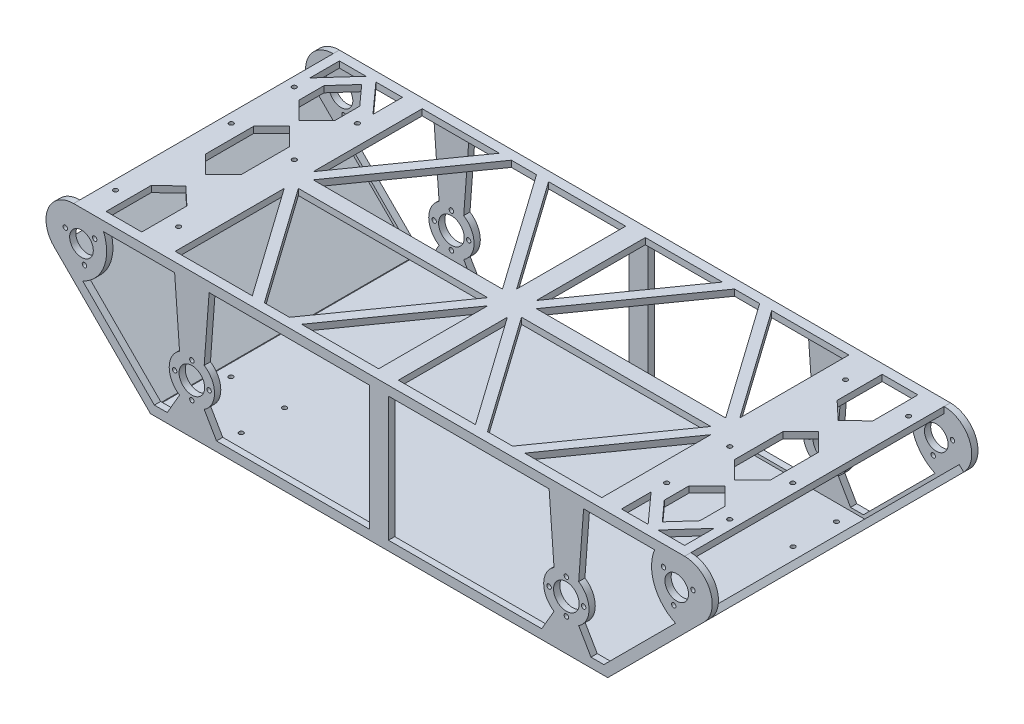
from build123d import *

# Parameters (mm, degrees)
SKETCH1_W               = 458.7573
SKETCH1_H               = 257
BOSS_EXTRUDE1_DEPTH     = 6.35
BOSS_EXTRUDE2_DEPTH     = 6.35
SKETCH3_W               = 619.980431394
SKETCH3_H               = 257
BOSS_EXTRUDE3_DEPTH     = 6.35
SKETCH5_W               = 269.7
SKETCH5_H               = 135.201969493
BOSS_EXTRUDE4_DEPTH     = 6.35
CUT_EXTRUDE1_DEPTH      = 455.343152175
CUT_EXTRUDE1_DEPTH_BACK = 455.343152175
SKETCH6_R               = 12
SKETCH6_R_2             = 13
SKETCH6_R_3             = 2.25
SKETCH7_R               = 2.25
CUT_EXTRUDE2_DEPTH      = 10
SKETCH8_R               = 2.25
CUT_EXTRUDE3_DEPTH      = 10
CUT_EXTRUDE4_DEPTH      = 455.343152175
CUT_EXTRUDE5_DEPTH      = 6.35


with BuildPart() as part:
    # Sketch1 → Boss-Extrude1 (new body)
    with BuildSketch(Plane(origin=(0, 0, 0), x_dir=(1, 0, 0), z_dir=(0, 1, 0))):
        Rectangle(SKETCH1_W, SKETCH1_H)
    extrude(amount=-BOSS_EXTRUDE1_DEPTH)

    # Sketch2 → Boss-Extrude2 (add)
    with BuildSketch(Plane.XY.offset(128.5)):
        with BuildLine():
            Line((329.824560909, 91.465654788), (232.008906121, -6.35))
            Line((232.008906121, -6.35), (-232.008906121, -6.35))
            Line((-232.008906121, -6.35), (-329.824560909, 91.465654788))
            ThreePointArc((-329.824560909, 91.465654788), (-335.905036583, 122.034270278), (-309.990215697, 139.35))
            Line((-309.990215697, 139.35), (309.990215697, 139.35))
            ThreePointArc((309.990215697, 139.35), (335.905036583, 122.034270278), (329.824560909, 91.465654788))
        make_face()
    boss_extrude2 = extrude(amount=BOSS_EXTRUDE2_DEPTH)

    # Mirror1: Boss-Extrude2 across plane
    add(boss_extrude2.mirror(Plane.XY))

    # Sketch3 → Boss-Extrude3 (add)
    with BuildSketch(Plane(origin=(0, 139.35, 0), x_dir=(1, 0, 0), z_dir=(0, 1, 0))):
        Rectangle(SKETCH3_W, SKETCH3_H)
    extrude(amount=-BOSS_EXTRUDE3_DEPTH)

    # Sketch5 → Boss-Extrude4 (add)
    with BuildSketch(Plane(origin=(119.179453061, -119.179453061, 0), x_dir=(0, 0, -1), z_dir=(0.7071067811865468, -0.7071067811865483, 0))):
        with Locations((0, 230.296183621)):
            Rectangle(SKETCH5_W, SKETCH5_H)
    boss_extrude4 = extrude(amount=-BOSS_EXTRUDE4_DEPTH)

    # Mirror5: Boss-Extrude4 across plane
    add(boss_extrude4.mirror(Plane(origin=(0, 0, 0), x_dir=(0, 0, 1), z_dir=(1, 0, 0))))

    # Sketch6 → Cut-Extrude1 (cut, two sides: drawn at the far end of the back side and taken through both)
    with BuildSketch(Plane.XY.offset(134.85).offset(-CUT_EXTRUDE1_DEPTH_BACK)):
        with Locations((-302.023340597, 108)):
            Circle(SKETCH6_R)
        with Locations((-190, 44)):
            Circle(SKETCH6_R_2)
        with Locations((190, 44)):
            Circle(SKETCH6_R_2)
        with Locations((302.023340597, 108)):
            Circle(SKETCH6_R)
        with Locations((-318.467961461, 113.985352508)):
            Circle(SKETCH6_R_3)
        with Locations((-298.984497488, 90.765864322)):
            Circle(SKETCH6_R_3)
        with Locations((-288.617562843, 119.24878317)):
            Circle(SKETCH6_R_3)
        with Locations((-190, 61.5)):
            Circle(SKETCH6_R_3)
        with Locations((-207.5, 44)):
            Circle(SKETCH6_R_3)
        with Locations((-190, 26.5)):
            Circle(SKETCH6_R_3)
        with Locations((-172.5, 44)):
            Circle(SKETCH6_R_3)
        with Locations((190, 26.5)):
            Circle(SKETCH6_R_3)
        with Locations((207.5, 44)):
            Circle(SKETCH6_R_3)
        with Locations((190, 61.5)):
            Circle(SKETCH6_R_3)
        with Locations((172.5, 44)):
            Circle(SKETCH6_R_3)
        with Locations((318.467961461, 113.985352508)):
            Circle(SKETCH6_R_3)
        with Locations((288.617562843, 119.24878317)):
            Circle(SKETCH6_R_3)
        with Locations((298.984497488, 90.765864322)):
            Circle(SKETCH6_R_3)
    extrude(amount=CUT_EXTRUDE1_DEPTH + CUT_EXTRUDE1_DEPTH_BACK, mode=Mode.SUBTRACT)

    # Sketch7 → Cut-Extrude2 (cut)
    with BuildSketch(Plane.XZ.offset(6.35)):
        with Locations(Location((-217.25, 112, 0), (0, 0, 270))):
            Circle(SKETCH7_R)
        with Locations(Location((-162.75, 112, 0), (0, 0, 270))):
            Circle(SKETCH7_R)
        with Locations(Location((-162.75, 68, 0), (0, 0, 270))):
            Circle(SKETCH7_R)
        with Locations(Location((-217.25, 68, 0), (0, 0, 270))):
            Circle(SKETCH7_R)
        with Locations(Location((217.25, -112, 0), (0, 0, 270))):
            Circle(SKETCH7_R)
        with Locations(Location((217.25, -68, 0), (0, 0, 270))):
            Circle(SKETCH7_R)
        with Locations(Location((162.75, -68, 0), (0, 0, 270))):
            Circle(SKETCH7_R)
        with Locations(Location((162.75, -112, 0), (0, 0, 270))):
            Circle(SKETCH7_R)
    extrude(amount=-CUT_EXTRUDE2_DEPTH, mode=Mode.SUBTRACT)

    # Sketch8 → Cut-Extrude3 (cut)
    with BuildSketch(Plane(origin=(0, 139.35, 0), x_dir=(1, 0, 0), z_dir=(0, 1, 0))):
        with Locations(Location((300.437964315, -15.52, 0), (0, 0, 180))):
            Circle(SKETCH8_R)
        with Locations(Location((236.437964315, -15.52, 0), (0, 0, 180))):
            Circle(SKETCH8_R)
        with Locations(Location((236.437964315, -79.52, 0), (0, 0, 180))):
            Circle(SKETCH8_R)
        with Locations(Location((300.437964315, -79.52, 0), (0, 0, 180))):
            Circle(SKETCH8_R)
        with Locations(Location((-300.437964315, 79.52, 0), (0, 0, 180))):
            Circle(SKETCH8_R)
        with Locations(Location((-236.437964315, 79.52, 0), (0, 0, 180))):
            Circle(SKETCH8_R)
        with Locations(Location((-236.437964315, 15.52, 0), (0, 0, 180))):
            Circle(SKETCH8_R)
        with Locations(Location((-300.437964315, 15.52, 0), (0, 0, 180))):
            Circle(SKETCH8_R)
        with Locations(Location((-300.437964315, -101.93, 0), (0, 0, 180))):
            Circle(SKETCH8_R)
        with Locations(Location((-236.437964315, -101.93, 0), (0, 0, 180))):
            Circle(SKETCH8_R)
        with Locations(Location((236.437964315, 101.93, 0), (0, 0, 180))):
            Circle(SKETCH8_R)
        with Locations(Location((300.437964315, 101.93, 0), (0, 0, 180))):
            Circle(SKETCH8_R)
    extrude(amount=-CUT_EXTRUDE3_DEPTH, mode=Mode.SUBTRACT)

    # Sketch9 → Cut-Extrude4 (cut, through all)
    with BuildSketch(Plane.XY.offset(134.85)):
        with BuildLine():
            Line((-9.525, 129.825), (-172.5, 129.825))
            Line((-172.5, 129.825), (-177.5, 63.306734576))
            ThreePointArc((-177.5, 63.306734576), (-167, 44), (-177.5, 24.693265424))
            Line((-177.5, 24.693265424), (-165, 3.175))
            Line((-165, 3.175), (-9.525, 3.175))
            Line((-9.525, 3.175), (-9.525, 129.825))
        make_face()
        with BuildLine():
            Line((-300.780064995, 75.891543056), (-228.063521939, 3.175))
            Line((-228.063521939, 3.175), (-215, 3.175))
            Line((-215, 3.175), (-202.5, 24.693265424))
            ThreePointArc((-202.5, 24.693265424), (-213, 44), (-202.5, 63.306734576))
            Line((-202.5, 63.306734576), (-207.5, 129.825))
            Line((-207.5, 129.825), (-279.569303806, 129.825))
            ThreePointArc((-279.569303806, 129.825), (-279.381979686, 98.61375439), (-300.780064995, 75.891543056))
        make_face()
        with BuildLine():
            Line((207.5, 129.825), (279.569303806, 129.825))
            ThreePointArc((279.569303806, 129.825), (279.381979686, 98.61375439), (300.780064995, 75.891543056))
            Line((300.780064995, 75.891543056), (228.063521939, 3.175))
            Line((228.063521939, 3.175), (215, 3.175))
            Line((215, 3.175), (202.5, 24.693265424))
            ThreePointArc((202.5, 24.693265424), (213, 44), (202.5, 63.306734576))
            Line((202.5, 63.306734576), (207.5, 129.825))
        make_face()
        with BuildLine():
            Line((165, 3.175), (9.525, 3.175))
            Line((9.525, 3.175), (9.525, 129.825))
            Line((9.525, 129.825), (172.5, 129.825))
            Line((172.5, 129.825), (177.5, 63.306734576))
            ThreePointArc((177.5, 63.306734576), (167, 44), (177.5, 24.693265424))
            Line((177.5, 24.693265424), (165, 3.175))
        make_face()
    extrude(amount=-CUT_EXTRUDE4_DEPTH, mode=Mode.SUBTRACT)

    # Sketch10 → Cut-Extrude5 (cut)
    with BuildSketch(Plane(origin=(0, 139.35, 0), x_dir=(1, 0, 0), z_dir=(0, 1, 0))):
        Polygon((-300.465215697, 125.325), (-300.465215697, 95.325), (-273.451590006, 125.325), align=None)
        Polygon((-263.451590006, 125.325), (-236.437964315, 125.325), (-236.437964315, 95.325), align=None)
        Polygon((-286.535814408, 95.85), (-268.451590006, 115.933447452), (-250.367365604, 95.85), (-250.367365604, 70.604224402), (-268.451590006, 52.52), (-286.535814408, 70.604224402), align=None)
        Polygon((-286.535814408, -24.435775598), (-286.535814408, 24.435775598), (-268.451590006, 42.52), (-250.367365604, 24.435775598), (-250.367365604, -24.435775598), (-268.451590006, -42.52), align=None)
        Polygon((-216.437964315, 125.325), (-216.437964315, 14.67455776), (-138.218982158, 125.325), align=None)
        Polygon((-88.218982158, 125.325), (-10, 125.325), (-10, 14.67455776), align=None)
        Polygon((-209.263406555, 7.5), (-125.972717552, 125.325), (-100.465246763, 125.325), (-17.17455776, 7.5), align=None)
        Polygon((-286.535814408, -79.52), (-268.451590006, -62.52), (-250.367365604, -79.52), (-250.367365604, -125.325), (-286.535814408, -125.325), align=None)
        Polygon((-100.465246763, -125.325), (-125.972717552, -125.325), (-209.263406555, -7.5), (-17.17455776, -7.5), align=None)
        Polygon((-10, -14.67455776), (-88.218982158, -125.325), (-10, -125.325), align=None)
        Polygon((-216.437964315, -125.325), (-138.218982158, -125.325), (-216.437964315, -14.67455776), align=None)
        Polygon((216.437964315, -125.325), (216.437964315, -14.67455776), (138.218982158, -125.325), align=None)
        Polygon((88.218982158, -125.325), (10, -125.325), (10, -14.67455776), align=None)
        Polygon((209.263406555, -7.5), (125.972717552, -125.325), (100.465246763, -125.325), (17.17455776, -7.5), align=None)
        Polygon((100.465246763, 125.325), (125.972717552, 125.325), (209.263406555, 7.5), (17.17455776, 7.5), align=None)
        Polygon((10, 14.67455776), (88.218982158, 125.325), (10, 125.325), align=None)
        Polygon((216.437964315, 125.325), (138.218982158, 125.325), (216.437964315, 14.67455776), align=None)
        Polygon((286.535814408, 24.435775598), (286.535814408, -24.435775598), (268.451590006, -42.52), (250.367365604, -24.435775598), (250.367365604, 24.435775598), (268.451590006, 42.52), align=None)
        Polygon((300.465215697, -95.325), (273.451590006, -125.325), (300.465215697, -125.325), align=None)
        Polygon((236.437964315, -95.325), (263.451590006, -125.325), (236.437964315, -125.325), align=None)
        Polygon((268.451590006, -115.933447452), (250.367365604, -95.85), (250.367365604, -70.604224402), (268.451590006, -52.52), (286.535814408, -70.604224402), (286.535814408, -95.85), align=None)
        Polygon((286.535814408, 125.325), (286.535814408, 79.52), (268.451590006, 62.52), (250.367365604, 79.52), (250.367365604, 125.325), align=None)
    extrude(amount=-CUT_EXTRUDE5_DEPTH, mode=Mode.SUBTRACT)


solid = part.part
